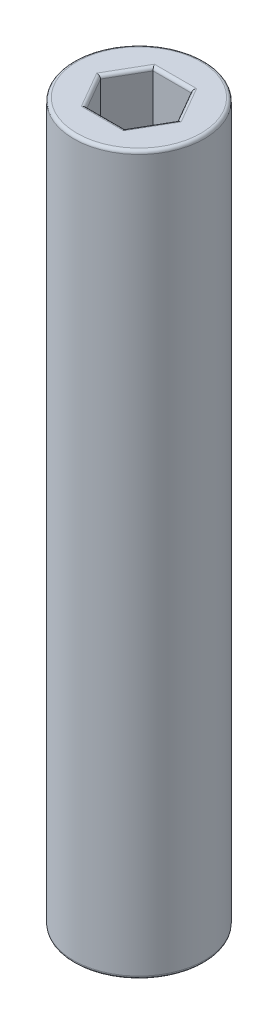
from build123d import *

# Parameters (mm, degrees)
SKETCH1_R           = 12.7
BOSS_EXTRUDE1_DEPTH = 139.7
FILLET1_R           = 0.635


with BuildPart() as part:
    # Sketch1 → Boss-Extrude1 (new body)
    with BuildSketch(Plane(origin=(0, 0, 0), x_dir=(1, 0, 0), z_dir=(0, 1, 0))):
        with Locations(Location((0, 0, 0), (0, 0, 270))):
            Circle(SKETCH1_R)
        Polygon((7.478995387, 0), (3.739497694, 6.477), (-3.739497694, 6.477), (-7.478995387, 0), (-3.739497694, -6.477), (3.739497694, -6.477), align=None, mode=Mode.SUBTRACT)
    extrude(amount=BOSS_EXTRUDE1_DEPTH)

    # Fillet1
    fillet1_edges = [part.edges().sort_by_distance(p)[0] for p in [
        (0, 0, -6.477),
        (-5.60924654, 0, -3.2385),
        (-5.60924654, 0, 3.2385),
        (0, 0, 6.477),
        (5.60924654, 139.7, 3.2385),
        (5.60924654, 139.7, -3.2385),
        (0, 139.7, -6.477),
        (-5.60924654, 139.7, -3.2385),
        (-5.60924654, 139.7, 3.2385),
        (0, 139.7, 6.477),
        (0, 0, -12.7),
        (0, 139.7, -12.7),
        (5.60924654, 0, 3.2385),
        (5.60924654, 0, -3.2385),
    ]]
    fillet(fillet1_edges, radius=FILLET1_R)


solid = part.part
